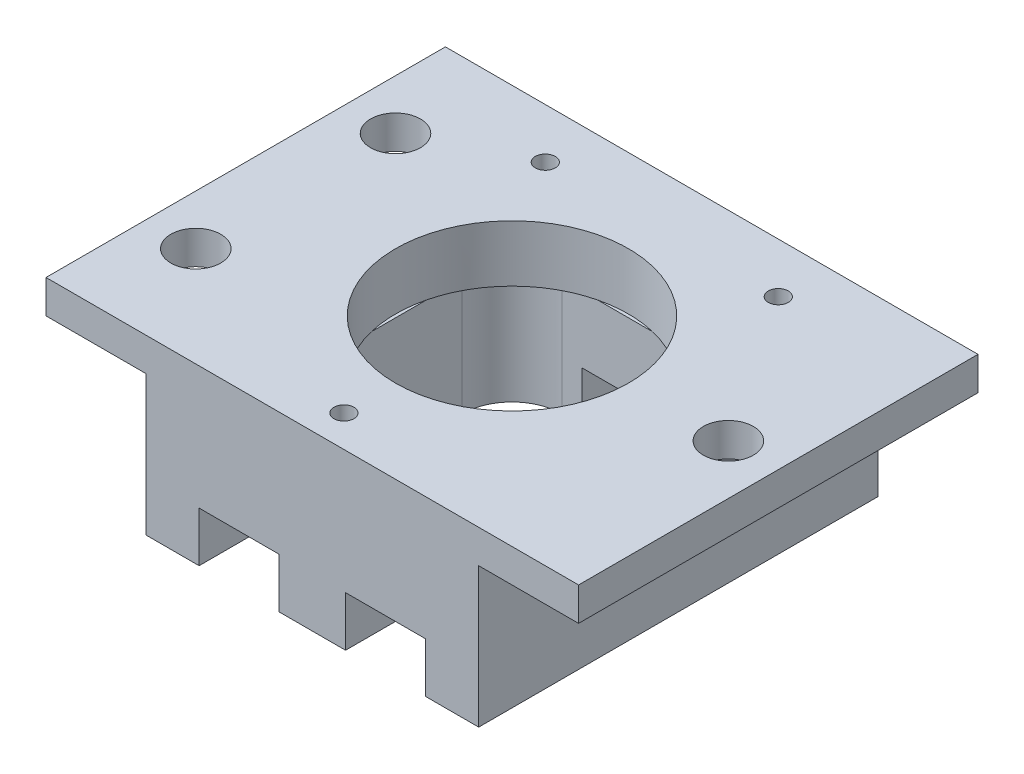
from build123d import *

# Parameters (mm, degrees)
SKETCH_1_W          = 10
SKETCH_1_H          = 12
SKETCH_1_R          = 3.5
EXTRUDE_1_DEPTH     = 1.7
SKETCH_4_W          = 10
SKETCH_4_H          = 12
EXTRUDE_2_DEPTH     = 3.5
EXTRUDE_START       = -1.7
SKETCH_4_4_W        = 3
SKETCH_4_4_H        = 12
EXTRUDE_3_DEPTH     = 1
CUT_EXTRUDE_START   = 3.5
SKETCH_4_3_W        = 2.4
SKETCH_4_3_H        = 1.9
CUT_EXTRUDE_2_DEPTH = 1.5
CUT_EXTRUDE_START_2 = -5.2
SKETCH_5_R          = 0.3
CUT_EXTRUDE_5_DEPTH = 4
SKETCH_5_6_R        = 0.3
SKETCH_5_6_R_2      = 0.75
CUT_EXTRUDE_6_DEPTH = 12.271202243


with BuildPart() as part:
    # 草图1 → 凸台-拉伸1 (new body)
    with BuildSketch(Plane(origin=(0, 0, 0), x_dir=(1, 0, 0), z_dir=(0, 1, 0))):
        Rectangle(SKETCH_1_W, SKETCH_1_H)
        with Locations(Location((0, 0, 0), (0, 0, 270))):
            Circle(SKETCH_1_R, mode=Mode.SUBTRACT)
    extrude(amount=EXTRUDE_1_DEPTH)

    # 草图4 → 凸台-拉伸2 (add)
    with BuildSketch(Plane.XZ):
        Rectangle(SKETCH_4_W, SKETCH_4_H)
        with BuildLine():
            Line((3.4, 4.1), (3.4, -1.9))
            ThreePointArc((3.4, -1.9), (2.960660172, -2.960660172), (1.9, -3.4))
            Line((1.9, -3.4), (-1.9, -3.4))
            ThreePointArc((-1.9, -3.4), (-2.960660172, -2.960660172), (-3.4, -1.9))
            Line((-3.4, -1.9), (-3.4, 4.1))
            Line((-3.4, 4.1), (3.4, 4.1))
        make_face(mode=Mode.SUBTRACT)
    extrude(amount=EXTRUDE_2_DEPTH)

    # 草图4<4> → 凸台-拉伸3 (add)
    with BuildSketch(Plane.XZ.offset(EXTRUDE_START)):
        with Locations((-6.5, 0)):
            Rectangle(SKETCH_4_4_W, SKETCH_4_4_H)
        with Locations((6.5, 0)):
            Rectangle(SKETCH_4_4_W, SKETCH_4_4_H)
    extrude(amount=EXTRUDE_3_DEPTH)

    # 草图4<3> → 切除-拉伸2 (cut)
    with BuildSketch(Plane.XZ.offset(CUT_EXTRUDE_START)):
        with Locations((-2.2, 5.05)):
            Rectangle(SKETCH_4_3_W, SKETCH_4_3_H)
        with Locations((2.2, 5.05)):
            Rectangle(SKETCH_4_3_W, SKETCH_4_3_H)
        with BuildLine():
            Line((1.3, -6), (1.3, -3.4))
            Line((1.3, -3.4), (0.830662386, -3.4))
            ThreePointArc((0.830662386, -3.4), (0, -3.5), (-0.830662386, -3.4))
            Line((-0.830662386, -3.4), (-1.3, -3.4))
            Line((-1.3, -3.4), (-1.3, -6))
            Line((-1.3, -6), (1.3, -6))
        make_face()
        with BuildLine():
            ThreePointArc((-0.830662386, -3.4), (0, -3.5), (0.830662386, -3.4))
            Line((0.830662386, -3.4), (-0.830662386, -3.4))
        make_face()
    extrude(amount=-CUT_EXTRUDE_2_DEPTH, mode=Mode.SUBTRACT)

    # 草图5 → 切除-拉伸5 (cut)
    with BuildSketch(Plane(origin=(0, 1.7, 0), x_dir=(1, 0, 0), z_dir=(0, 1, 0)).offset(CUT_EXTRUDE_START_2)):
        with Locations(Location((3.5, 4.5, 0), (0, 0, 270))):
            Circle(SKETCH_5_R)
        with Locations(Location((-3.5, 4.5, 0), (0, 0, 270))):
            Circle(SKETCH_5_R)
        with Locations(Location((0, -5.05, 0), (0, 0, 270))):
            Circle(SKETCH_5_R)
    extrude(amount=CUT_EXTRUDE_5_DEPTH, mode=Mode.SUBTRACT)

    # 草图5<6> → 切除-拉伸6 (cut, through all)
    with BuildSketch(Plane(origin=(0, 1.7, 0), x_dir=(1, 0, 0), z_dir=(0, 1, 0))):
        with Locations(Location((3.5, 4.5, 0), (0, 0, 270))):
            Circle(SKETCH_5_6_R)
        with Locations(Location((-3.5, 4.5, 0), (0, 0, 270))):
            Circle(SKETCH_5_6_R)
        with Locations(Location((0, -5.05, 0), (0, 0, 270))):
            Circle(SKETCH_5_6_R)
        with Locations(Location((6.5, 0, 0), (0, 0, 270))):
            Circle(SKETCH_5_6_R_2)
        with Locations(Location((-6.5, 3, 0), (0, 0, 270))):
            Circle(SKETCH_5_6_R_2)
        with Locations(Location((-6.5, -3, 0), (0, 0, 270))):
            Circle(SKETCH_5_6_R_2)
    extrude(amount=-CUT_EXTRUDE_6_DEPTH, mode=Mode.SUBTRACT)


solid = part.part
